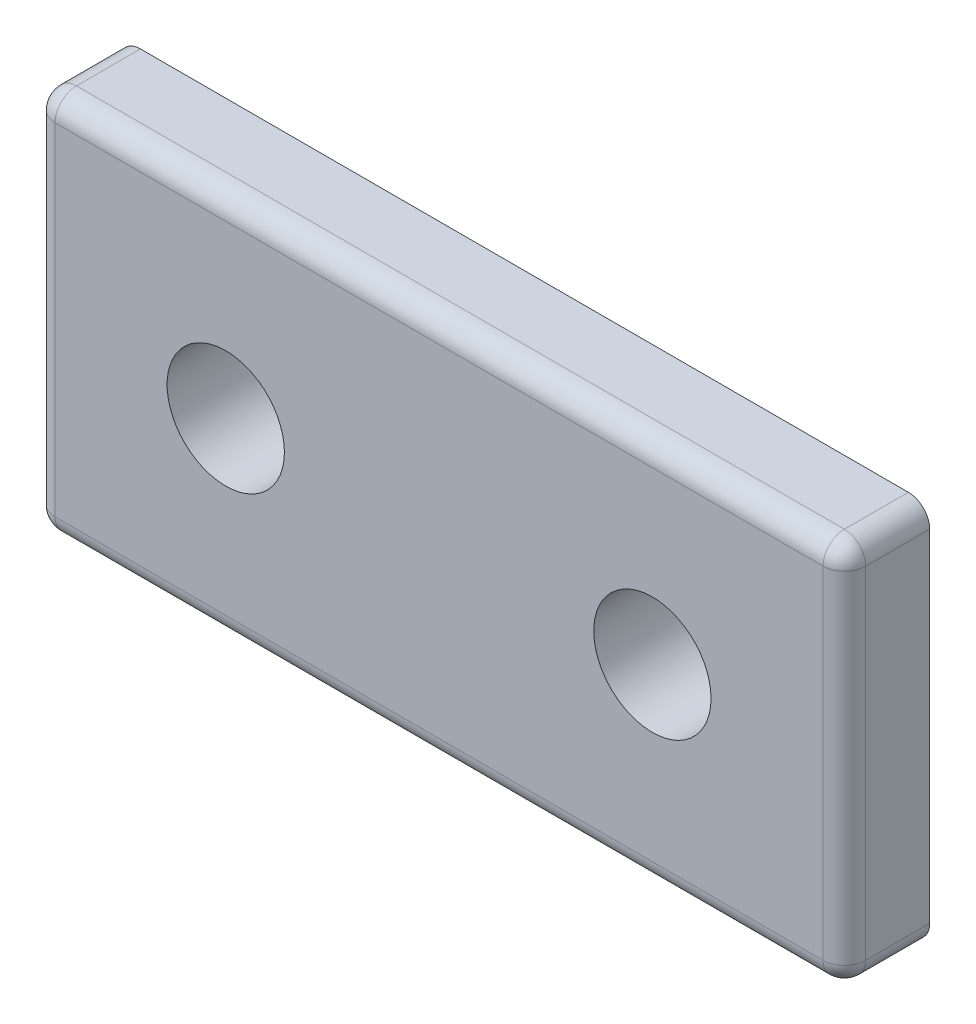
from build123d import *

# Parameters (mm, degrees)
SKETCH1_W           = 38
SKETCH1_H           = 18
SKETCH1_R           = 2.75
BOSS_EXTRUDE1_DEPTH = 2
FILLET1_R           = 1


with BuildPart() as part:
    # Sketch1 → Boss-Extrude1 (new, symmetric)
    with BuildSketch(Plane.XY):
        with Locations((19, 9)):
            Rectangle(SKETCH1_W, SKETCH1_H)
        with Locations((9, 9)):
            Circle(SKETCH1_R, mode=Mode.SUBTRACT)
        with Locations((29, 9)):
            Circle(SKETCH1_R, mode=Mode.SUBTRACT)
    extrude(amount=BOSS_EXTRUDE1_DEPTH, both=True)

    # Fillet1
    fillet1_edges = [part.edges().sort_by_distance(p)[0] for p in [
        (19, 18, 2),
        (0, 9, 2),
        (19, 0, 2),
        (38, 9, 2),
        (0, 0, 0),
        (0, 18, 0),
        (38, 18, 0),
        (38, 0, 0),
    ]]
    fillet(fillet1_edges, radius=FILLET1_R)


solid = part.part
